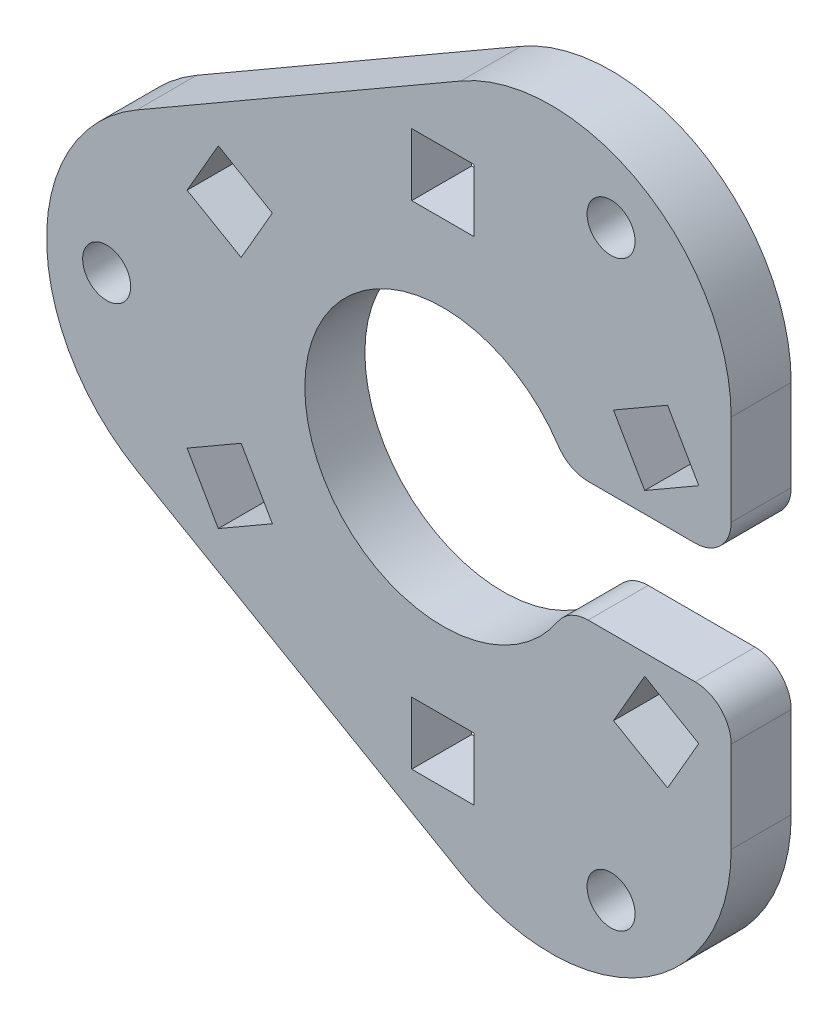
from build123d import *

# Parameters (mm, degrees)
SKETCH1_R           = 2
SKETCH1_W           = 5.2
SKETCH1_H           = 5.2
BOSS_EXTRUDE1_DEPTH = 5
CONG_1_R            = 15
CONG_2_R            = 3


with BuildPart() as part:
    # Sketch1 → Boss-Extrude1 (new body)
    with BuildSketch(Plane.XY):
        with BuildLine():
            Line((24, 5), (24, 41.569219382))
            Line((24, 41.569219382), (-48, 0))
            Line((-48, 0), (24, -41.569219382))
            Line((24, -41.569219382), (24, -5))
            Line((24, -5), (10.356157589, -5))
            ThreePointArc((10.356157589, -5), (-11.5, 0), (10.356157589, 5))
            Line((10.356157589, 5), (24, 5))
        make_face()
        with Locations((14, 24.248711306)):
            Circle(SKETCH1_R, mode=Mode.SUBTRACT)
        with Locations((14, -24.248711306)):
            Circle(SKETCH1_R, mode=Mode.SUBTRACT)
        with Locations((-28, 0)):
            Circle(SKETCH1_R, mode=Mode.SUBTRACT)
        with Locations((0, 20.5)):
            Rectangle(SKETCH1_W, SKETCH1_H, mode=Mode.SUBTRACT)
        Polygon((21.305186827, 9.29833395), (16.801854728, 6.69833395), (14.201854728, 11.20166605), (18.705186827, 13.80166605), align=None, mode=Mode.SUBTRACT)
        Polygon((18.705186827, -13.80166605), (14.201854728, -11.20166605), (16.801854728, -6.69833395), (21.305186827, -9.29833395), align=None, mode=Mode.SUBTRACT)
        with Locations((0, -20.5)):
            Rectangle(SKETCH1_W, SKETCH1_H, mode=Mode.SUBTRACT)
        Polygon((-21.305186827, -9.29833395), (-16.801854728, -6.69833395), (-14.201854728, -11.20166605), (-18.705186827, -13.80166605), align=None, mode=Mode.SUBTRACT)
        Polygon((-18.705186827, 13.80166605), (-14.201854728, 11.20166605), (-16.801854728, 6.69833395), (-21.305186827, 9.29833395), align=None, mode=Mode.SUBTRACT)
    extrude(amount=BOSS_EXTRUDE1_DEPTH)

    # Congé1
    cong_1_edges = [part.edges().sort_by_distance(p)[0] for p in [
        (24, -41.569219382, 2.5),
        (-48, 0, 2.5),
        (24, 41.569219382, 2.5),
    ]]
    fillet(cong_1_edges, radius=CONG_1_R)

    # Congé2
    cong_2_edges = [part.edges().sort_by_distance(p)[0] for p in [
        (10.356157589, 5, 2.5),
        (10.356157589, -5, 2.5),
        (24, -5, 2.5),
        (24, 5, 2.5),
    ]]
    fillet(cong_2_edges, radius=CONG_2_R)


solid = part.part
